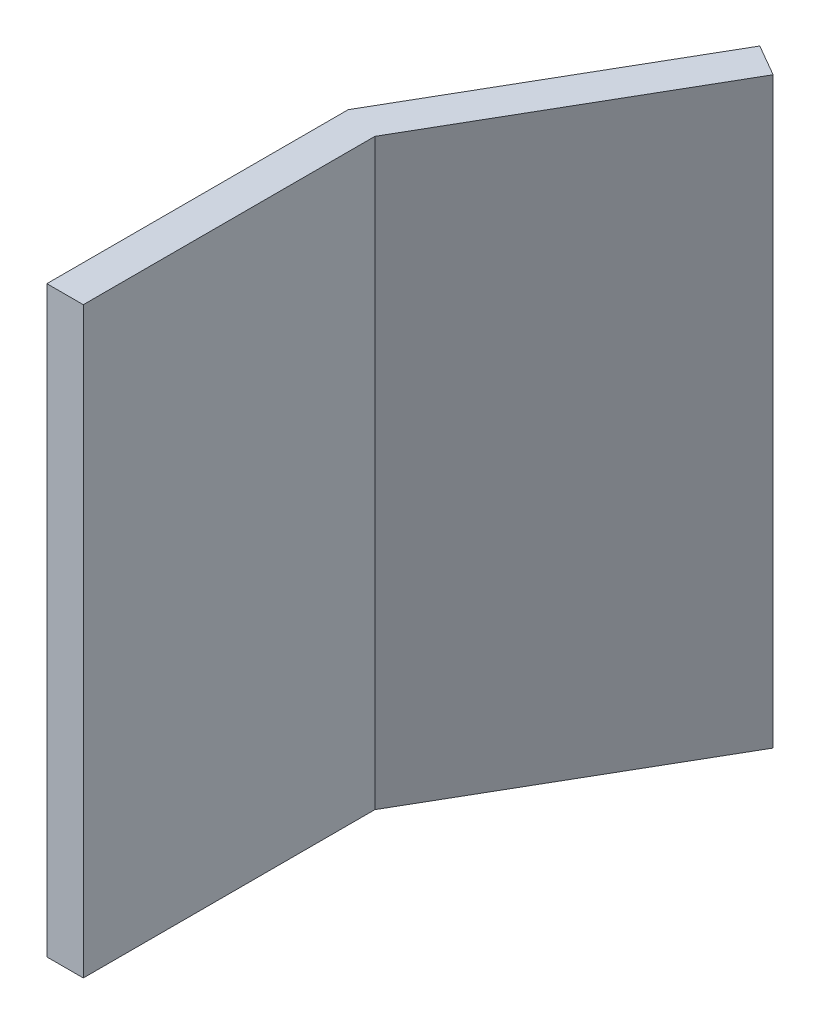
from build123d import *

# Parameters (mm, degrees)
BOSS_EXTRUDE1_DEPTH = 50.8


with BuildPart() as part:
    # Sketch1 → Boss-Extrude1 (new body)
    with BuildSketch(Plane(origin=(0, 0, 0), x_dir=(1, 0, 0), z_dir=(0, 1, 0))):
        Polygon((2.749630657, -1.5875), (0, 0), (0, -26.250738686), (3.175, -26.250738686), (3.175, -0.850738686), align=None)
        Polygon((15.875, 21.14630657), (13.125369343, 22.73380657), (0, 0), (3.175, 0), (3.175, -0.850738686), align=None)
        Polygon((3.175, 0), (0, 0), (2.749630657, -1.5875), (3.175, -0.850738686), align=None)
    extrude(amount=BOSS_EXTRUDE1_DEPTH)


solid = part.part
